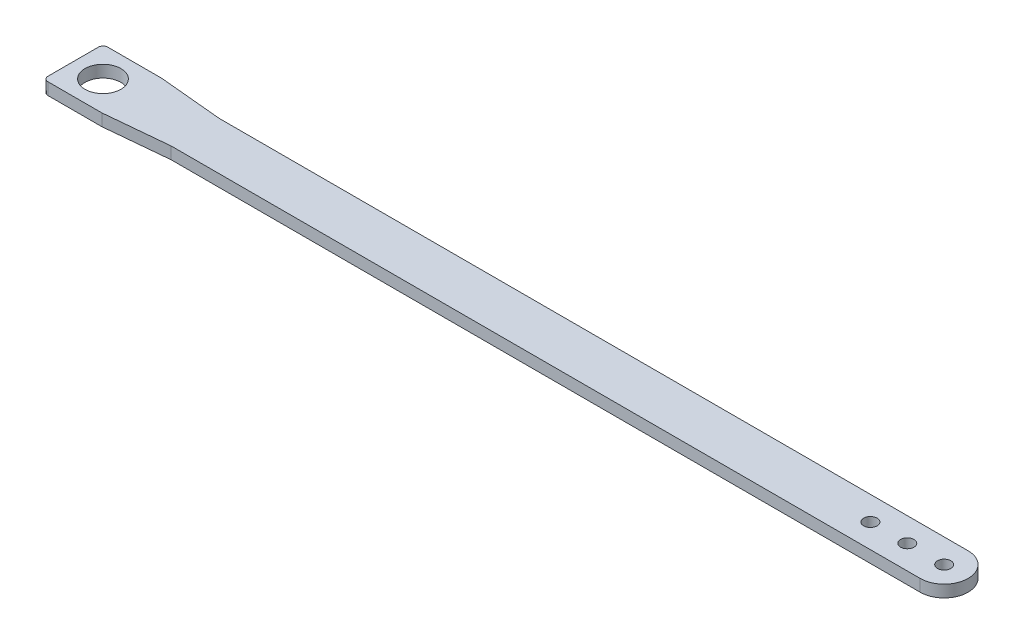
from build123d import *

# Parameters (mm, degrees)
SKETCH1_R           = 1.778
BOSS_EXTRUDE1_DEPTH = 3.175
SKETCH2_W           = 165.78896247
SKETCH2_H           = 45.115138018
CUT_EXTRUDE1_DEPTH  = 127
SKETCH3_R           = 4.7625
CUT_EXTRUDE2_DEPTH  = 127
SKETCH4_R           = 1.778
CUT_EXTRUDE3_DEPTH  = 127
BOSS_EXTRUDE2_DEPTH = 3.175
FILLET3_R           = 1.27
BOSS_EXTRUDE3_DEPTH = 3.175


with BuildPart() as part:
    # Sketch1 → Boss-Extrude1 (new body)
    with BuildSketch(Plane(origin=(0, 6.35, 0), x_dir=(1, 0, 0), z_dir=(0, 1, 0))):
        with BuildLine():
            Line((187.7568, 6.985), (-187.7568, 6.985))
            ThreePointArc((-187.7568, 6.985), (-194.1068, 0.635), (-187.7568, -5.715))
            Line((-187.7568, -5.715), (187.7568, -5.715))
            ThreePointArc((187.7568, -5.715), (194.1068, 0.635), (187.7568, 6.985))
        make_face()
        with Locations(Location((187.7568, 0.635, 0), (0, 0, 90))):
            Circle(SKETCH1_R, mode=Mode.SUBTRACT)
        with Locations(Location((-187.7568, 0.635, 0), (0, 0, 90))):
            Circle(SKETCH1_R, mode=Mode.SUBTRACT)
    extrude(amount=-BOSS_EXTRUDE1_DEPTH)

    # Sketch2 → Cut-Extrude1 (cut)
    with BuildSketch(Plane(origin=(0, 6.35, 0), x_dir=(1, 0, 0), z_dir=(0, 1, 0))):
        with Locations((-124.419845051, -4.918181187)):
            Rectangle(SKETCH2_W, SKETCH2_H)
    extrude(amount=-CUT_EXTRUDE1_DEPTH, mode=Mode.SUBTRACT)

    # Sketch3 → Cut-Extrude2 (cut)
    with BuildSketch(Plane(origin=(0, 6.35, 0), x_dir=(1, 0, 0), z_dir=(0, 1, 0))):
        with Locations(Location((-35.2044, 0.635, 0), (0, 0, 270))):
            Circle(SKETCH3_R)
    extrude(amount=-CUT_EXTRUDE2_DEPTH, mode=Mode.SUBTRACT)

    # Sketch4 → Cut-Extrude3 (cut)
    with BuildSketch(Plane(origin=(0, 6.35, 0), x_dir=(1, 0, 0), z_dir=(0, 1, 0))):
        with Locations(Location((168.1988, 0.635, 0), (0, 0, 270))):
            Circle(SKETCH4_R)
        with Locations(Location((177.9778, 0.635, 0), (0, 0, 270))):
            Circle(SKETCH4_R)
    extrude(amount=-CUT_EXTRUDE3_DEPTH, mode=Mode.SUBTRACT)

    # Sketch5 → Boss-Extrude2 (add)
    with BuildSketch(Plane(origin=(0, 6.35, 0), x_dir=(1, 0, 0), z_dir=(0, 1, 0))):
        Polygon((-27.555842436, 6.985), (-41.525363816, 6.985), (-41.525363816, -5.715), (-27.555842436, -5.715), (-27.555842436, -7.3025), (-41.525363816, -7.3025), (-43.112863816, -7.3025), (-43.112863816, 8.5725), (-41.525363816, 8.5725), (-27.555842436, 8.5725), align=None)
    extrude(amount=-BOSS_EXTRUDE2_DEPTH)

    # Fillet3
    fillet3_edges = [part.edges().sort_by_distance(p)[0] for p in [
        (-43.112863816, 4.7625, 7.3025),
        (-43.112863816, 4.7625, -8.5725),
    ]]
    fillet(fillet3_edges, radius=FILLET3_R)

    # Sketch6 → Boss-Extrude3 (add)
    with BuildSketch(Plane(origin=(0, 6.35, 0), x_dir=(1, 0, 0), z_dir=(0, 1, 0))):
        Polygon((-27.555842436, 8.5725), (-10.771352163, 6.985), (-27.555842436, 6.985), align=None)
        Polygon((-27.555842436, -7.3025), (-10.771352163, -5.715), (-27.555842436, -5.715), align=None)
    extrude(amount=-BOSS_EXTRUDE3_DEPTH)


solid = part.part
